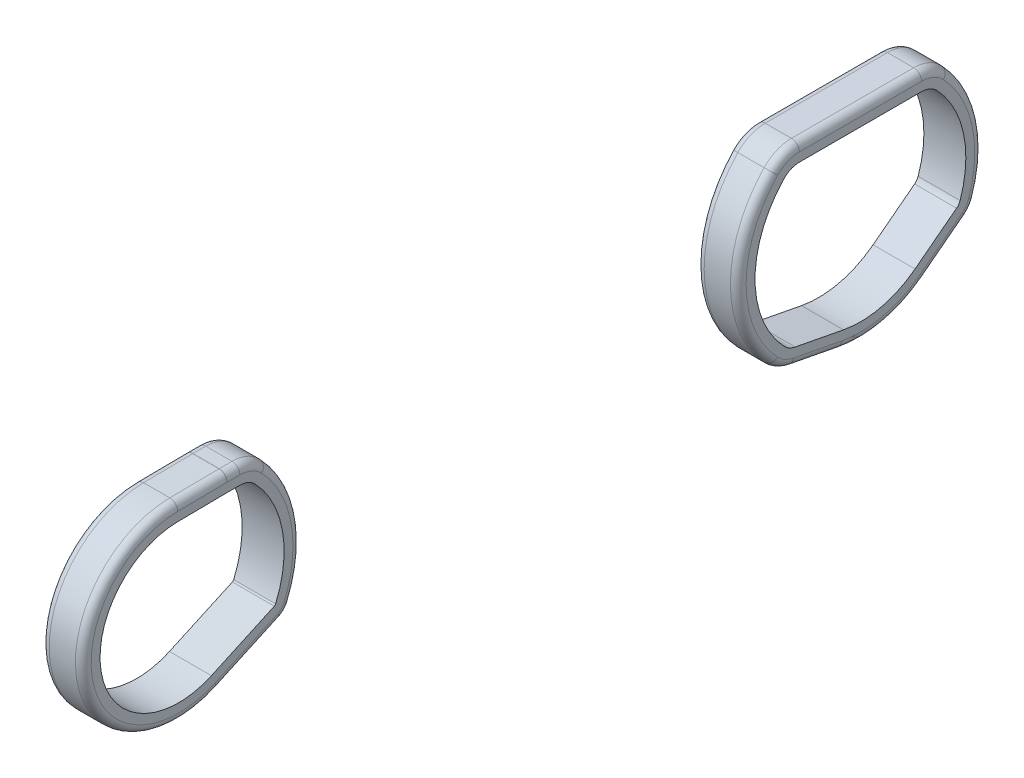
from build123d import *

# Parameters (mm, degrees)
BOSS_EXTRUDE1_DEPTH   = 2
BOSS_EXTRUDE1_2_DEPTH = 2
FILLET1_R             = 0.75
FILLET2_R             = 0.75


with BuildPart() as part:
    # Sketch2 → Boss-Extrude1 (new, symmetric)
    with BuildSketch(Plane(origin=(0, 0, 0), x_dir=(0, 0, -1), z_dir=(1, 0, 0))):
        with BuildLine():
            Line((38.680908936, -8.051016378), (42.638986873, -5.012329319))
            ThreePointArc((42.638986873, -5.012329319), (43.165658722, -4.469234537), (43.513690973, -3.797513812))
            ThreePointArc((43.513690973, -3.797513812), (43.883409513, 2.478000778), (40.938582556, 8.031987578))
            ThreePointArc((40.938582556, 8.031987578), (39.749550626, 8.858712384), (38.330951895, 9.15))
            Line((38.330951895, 9.15), (26.669048105, 9.15))
            ThreePointArc((26.669048105, 9.15), (25.250449374, 8.858712384), (24.061417444, 8.031987578))
            ThreePointArc((24.061417444, 8.031987578), (20.85, 0), (24.061417444, -8.031987578))
            ThreePointArc((24.061417444, -8.031987578), (24.943446907, -8.709477885), (25.990176628, -9.085411365))
            Line((25.990176628, -9.085411365), (30.585959585, -9.967895931))
            ThreePointArc((30.585959585, -9.967895931), (34.83883487, -9.876859392), (38.680908936, -8.051016378))
        make_face()
        with BuildLine():
            Line((26.669048105, 7.55), (38.330951895, 7.55))
            ThreePointArc((38.330951895, 7.55), (39.119062301, 7.388173547), (39.779635595, 6.928881988))
            ThreePointArc((39.779635595, 6.928881988), (42.320022799, 2.137674491), (42.001081054, -3.275966851))
            ThreePointArc((42.001081054, -3.275966851), (41.867222496, -3.534320976), (41.6646564, -3.743203584))
            Line((41.6646564, -3.743203584), (37.706578463, -6.781890644))
            ThreePointArc((37.706578463, -6.781890644), (34.470151541, -8.31991604), (30.887680242, -8.396601991))
            Line((30.887680242, -8.396601991), (26.291897285, -7.514117425))
            ThreePointArc((26.291897285, -7.514117425), (25.710380773, -7.305265492), (25.220364405, -6.928881988))
            ThreePointArc((25.220364405, -6.928881988), (22.45, 0), (25.220364405, 6.928881988))
            ThreePointArc((25.220364405, 6.928881988), (25.880937699, 7.388173547), (26.669048105, 7.55))
        make_face(mode=Mode.SUBTRACT)
    extrude(amount=BOSS_EXTRUDE1_DEPTH, both=True)

    # Fillet1
    fillet1_edges = [part.edges().sort_by_distance(p)[0] for p in [
        (2, -4.469234537, -43.165658722),
        (-2, 0, -20.85),
        (-2, 8.858712384, -25.250449374),
        (-2, 9.15, -32.5),
        (-2, 8.858712384, -39.749550626),
        (-2, 2.478000778, -43.883409513),
        (-2, -4.469234537, -43.165658722),
        (-2, -6.531672849, -40.659947904),
        (-2, -9.876859392, -34.83883487),
        (2, 2.478000778, -43.883409513),
        (2, 8.858712384, -39.749550626),
        (2, 9.15, -32.5),
        (2, 8.858712384, -25.250449374),
        (2, 0, -20.85),
        (2, -8.709477885, -24.943446907),
        (2, -9.526653648, -28.288068107),
        (2, -9.876859392, -34.83883487),
        (2, -6.531672849, -40.659947904),
        (-2, -9.526653648, -28.288068107),
        (-2, -8.709477885, -24.943446907),
    ]]
    fillet(fillet1_edges, radius=FILLET1_R)


with BuildPart() as body_2:
    # Sketch2 → Boss-Extrude1 2 (new, symmetric)
    with BuildSketch(Plane(origin=(0, 0, 0), x_dir=(0, 0, -1), z_dir=(1, 0, 0))):
        with BuildLine():
            Line((-32.597839378, 9.099474021), (-27.91268728, 9.14984972))
            ThreePointArc((-27.91268728, 9.14984972), (-27.898710428, 9.14996243), (-27.884733172, 9.15))
            Line((-27.884733172, 9.15), (-26.669048105, 9.15))
            ThreePointArc((-26.669048105, 9.15), (-25.250449374, 8.858712384), (-24.061417444, 8.031987578))
            ThreePointArc((-24.061417444, 8.031987578), (-21.034885432, 2.067280325), (-21.78755022, -4.578855721))
            ThreePointArc((-21.78755022, -4.578855721), (-22.164331782, -5.143496424), (-22.7194136, -5.534223493))
            Line((-22.7194136, -5.534223493), (-28.716095774, -8.275993524))
            ThreePointArc((-28.716095774, -8.275993524), (-41.381074632, -1.984064864), (-32.597839378, 9.099474021))
        make_face()
        with BuildLine():
            Line((-26.669048105, 7.55), (-27.884733172, 7.55))
            ThreePointArc((-27.884733172, 7.55), (-27.89010904, 7.54998555), (-27.895484752, 7.5499422))
            Line((-27.895484752, 7.5499422), (-32.58063685, 7.499566501))
            ThreePointArc((-32.58063685, 7.499566501), (-39.819567004, -1.635218294), (-29.381397616, -6.820873784))
            Line((-29.381397616, -6.820873784), (-23.384715442, -4.079103753))
            ThreePointArc((-23.384715442, -4.079103753), (-23.309704386, -4.026302798), (-23.258787958, -3.95))
            ThreePointArc((-23.258787958, -3.95), (-22.609493441, 1.783361997), (-25.220364405, 6.928881988))
            ThreePointArc((-25.220364405, 6.928881988), (-25.880937699, 7.388173547), (-26.669048105, 7.55))
        make_face(mode=Mode.SUBTRACT)
    extrude(amount=BOSS_EXTRUDE1_2_DEPTH, both=True)

    # Fillet2
    fillet2_edges = [body_2.edges().sort_by_distance(p)[0] for p in [
        (2, -5.143496424, 22.164331782),
        (-2, -6.905108509, 25.717754687),
        (-2, -1.984064864, 41.381074632),
        (2, 2.067280325, 21.034885432),
        (2, 8.858712384, 25.250449374),
        (2, 9.15, 27.276890639),
        (2, 9.14996243, 27.898710428),
        (2, 9.124661871, 30.255263329),
        (2, -1.984064864, 41.381074632),
        (2, -6.905108509, 25.717754687),
        (-2, 9.124661871, 30.255263329),
        (-2, 9.14996243, 27.898710428),
        (-2, 9.15, 27.276890639),
        (-2, 8.858712384, 25.250449374),
        (-2, 2.067280325, 21.034885432),
        (-2, -5.143496424, 22.164331782),
    ]]
    fillet(fillet2_edges, radius=FILLET2_R)


solid = Compound([part.part, body_2.part])
